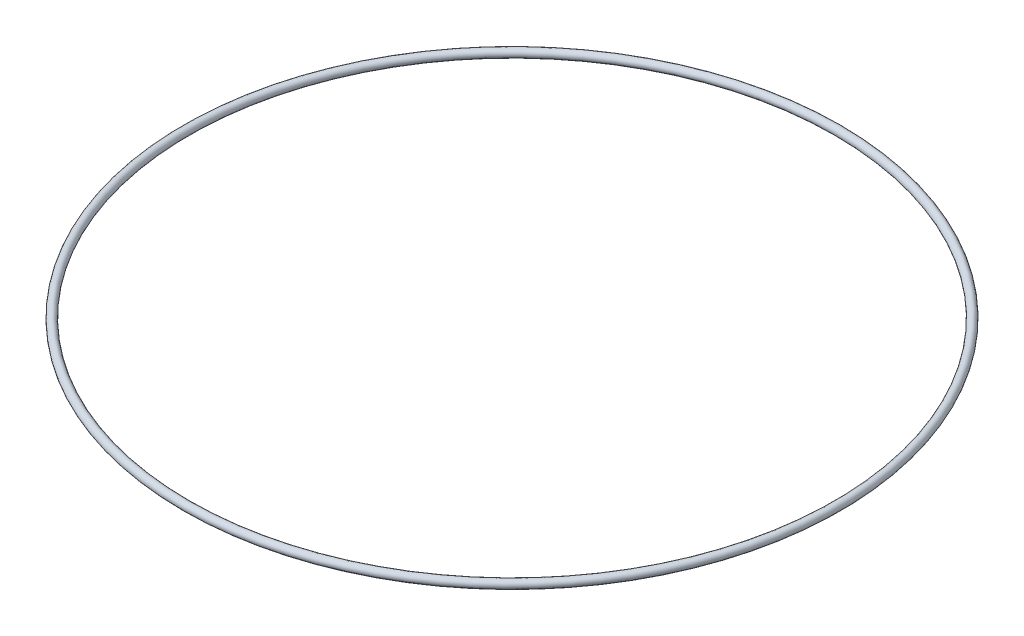
from build123d import *

# Parameters (mm, degrees)
ESQUISSE1_R = 0.25


with BuildPart() as part:
    # Esquisse1 → Révolution1 (revolve)
    with BuildSketch(Plane.XY, mode=Mode.PRIVATE) as r_volution1_sk:
        with Locations((-19.75, 0)):
            Circle(ESQUISSE1_R)
    revolve(r_volution1_sk.sketch.rotate(Axis((0, 0, 0), (0, 1, 0)), 270), axis=Axis((0, 0, 0), (0, 1, 0)))


solid = part.part
